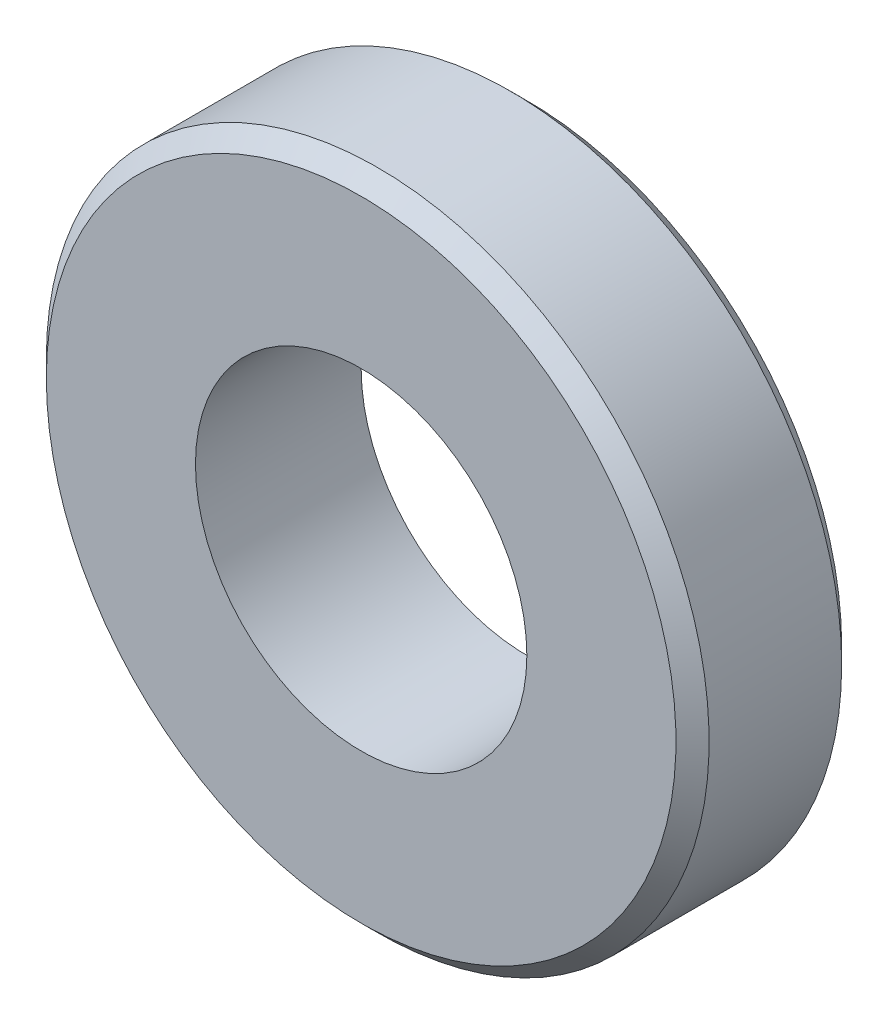
from build123d import *

# Parameters (mm, degrees)
SKETCH_1_W     = 10
SKETCH_1_H     = 10
CHAMFER_1_SIZE = 1


with BuildPart() as part:
    # 草图1 → 旋转1 (revolve)
    with BuildSketch(Plane(origin=(0, 0, 0), x_dir=(1, 0, 0), z_dir=(0, 1, 0)), mode=Mode.PRIVATE) as revolve_1_sk:
        with Locations((15, 0)):
            Rectangle(SKETCH_1_W, SKETCH_1_H)
    revolve(revolve_1_sk.sketch.rotate(Axis((0, 0, 0), (0, 0, 1)), 180), axis=Axis((0, 0, 0), (0, 0, 1)))

    # 倒角1
    chamfer_1_edges = [part.edges().sort_by_distance(p)[0] for p in [
        (20, 0, 5),
        (20, 0, -5),
    ]]
    chamfer(chamfer_1_edges, length=CHAMFER_1_SIZE)


solid = part.part
